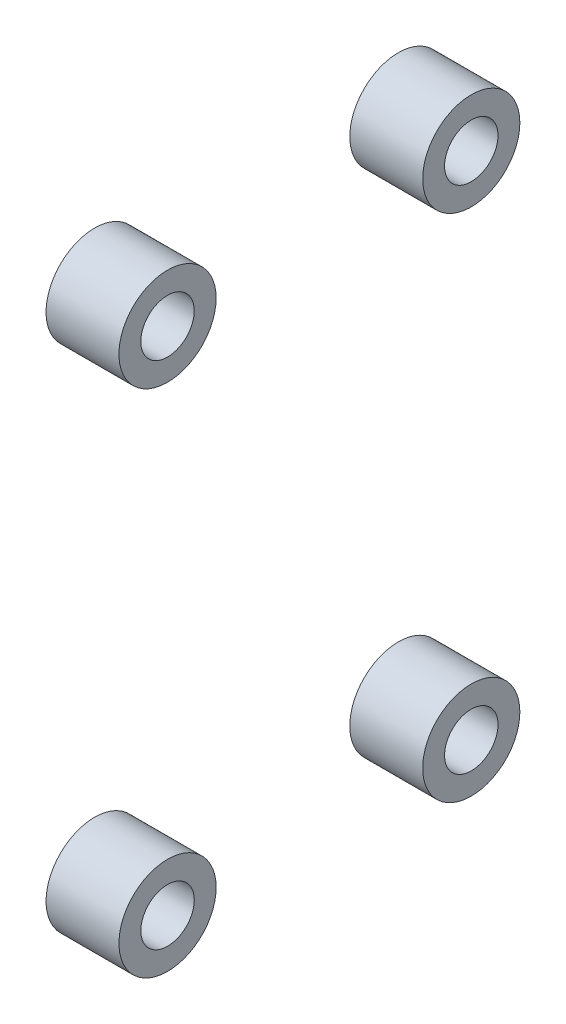
from build123d import *

# Parameters (mm, degrees)
CROQUIS1_R                = 2
SALIENTE_EXTRUIR1_DEPTH   = 3
SALIENTE_EXTRUIR1_2_DEPTH = 3
SALIENTE_EXTRUIR1_3_DEPTH = 3
SALIENTE_EXTRUIR1_4_DEPTH = 3
CROQUIS2_R                = 1.1
CORTAR_EXTRUIR1_DEPTH     = 5


with BuildPart() as part:
    # Croquis1 → Saliente-Extruir1 (new body)
    with BuildSketch(Plane(origin=(-15.9, 0, 0), x_dir=(0, 0, -1), z_dir=(1, 0, 0))):
        with Locations((-97, -10.5)):
            Circle(CROQUIS1_R)
    extrude(amount=SALIENTE_EXTRUIR1_DEPTH)


with BuildPart() as body_2:
    # Croquis1 → Saliente-Extruir1 2 (new body)
    with BuildSketch(Plane(origin=(-15.9, 0, 0), x_dir=(0, 0, -1), z_dir=(1, 0, 0))):
        with Locations((-84.5, -10.5)):
            Circle(CROQUIS1_R)
    extrude(amount=SALIENTE_EXTRUIR1_2_DEPTH)


with BuildPart() as body_3:
    # Croquis1 → Saliente-Extruir1 3 (new body)
    with BuildSketch(Plane(origin=(-15.9, 0, 0), x_dir=(0, 0, -1), z_dir=(1, 0, 0))):
        with Locations((-97, 10.5)):
            Circle(CROQUIS1_R)
    extrude(amount=SALIENTE_EXTRUIR1_3_DEPTH)


with BuildPart() as body_4:
    # Croquis1 → Saliente-Extruir1 4 (new body)
    with BuildSketch(Plane(origin=(-15.9, 0, 0), x_dir=(0, 0, -1), z_dir=(1, 0, 0))):
        with Locations((-84.5, 10.5)):
            Circle(CROQUIS1_R)
    extrude(amount=SALIENTE_EXTRUIR1_4_DEPTH)


with BuildPart() as cortar_extruir1_tool:
    # Croquis2 → Cortar-Extruir1 (new body)
    with BuildSketch(Plane(origin=(-16.9, 0, 0), x_dir=(0, 0, -1), z_dir=(1, 0, 0))):
        with Locations((-97, -10.5)):
            Circle(CROQUIS2_R)
        with Locations((-84.5, -10.5)):
            Circle(CROQUIS2_R)
        with Locations((-97, 10.5)):
            Circle(CROQUIS2_R)
        with Locations((-84.5, 10.5)):
            Circle(CROQUIS2_R)
    extrude(amount=CORTAR_EXTRUIR1_DEPTH)


with BuildPart() as part_1:
    add(part.part)

    # Cortar-Extruir1: cut by cortar_extruir1_tool
    add(cortar_extruir1_tool.part, mode=Mode.SUBTRACT)


with BuildPart() as body_2_1:
    add(body_2.part)

    # Cortar-Extruir1: cut by cortar_extruir1_tool
    add(cortar_extruir1_tool.part, mode=Mode.SUBTRACT)


with BuildPart() as body_3_1:
    add(body_3.part)

    # Cortar-Extruir1: cut by cortar_extruir1_tool
    add(cortar_extruir1_tool.part, mode=Mode.SUBTRACT)


with BuildPart() as body_4_1:
    add(body_4.part)

    # Cortar-Extruir1: cut by cortar_extruir1_tool
    add(cortar_extruir1_tool.part, mode=Mode.SUBTRACT)


solid = Compound([part_1.part, body_2_1.part, body_3_1.part, body_4_1.part])
